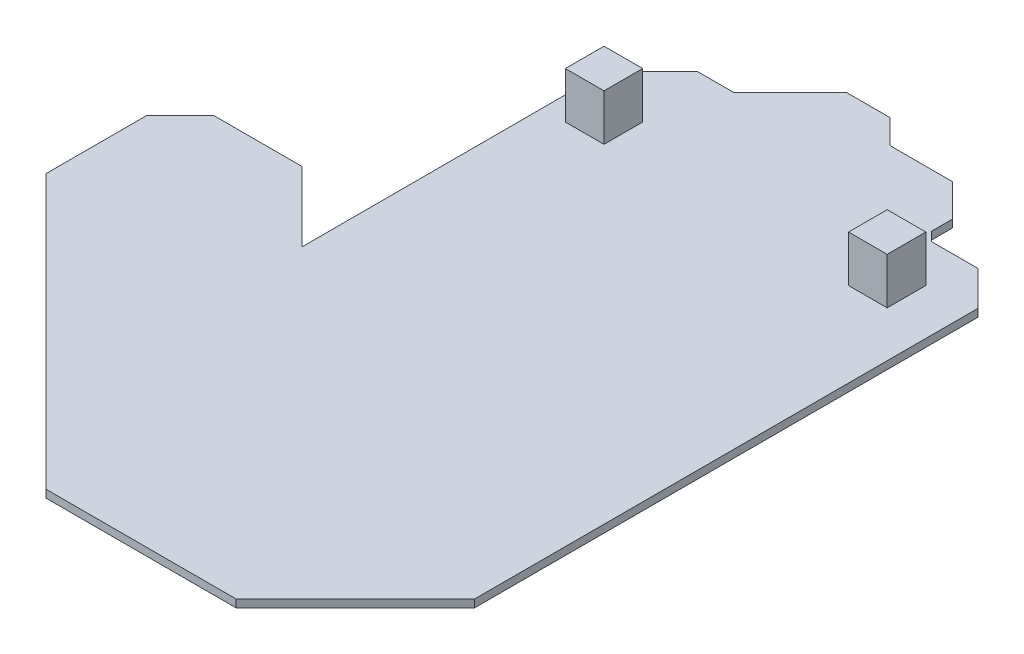
from build123d import *

# Parameters (mm, degrees)
RESSALTO_EXTRUS_O1_DEPTH = 1
ESBO_O2_W                = 5
ESBO_O2_H                = 5
RESSALTO_EXTRUS_O2_DEPTH = 6


with BuildPart() as part:
    # Esboço1 → Ressalto-extrusão1 (new body)
    with BuildSketch(Plane(origin=(0, 0, 0), x_dir=(1, 0, 0), z_dir=(0, 1, 0))):
        Polygon((-21.795929641, 4.783320054), (-12.808127222, -4.204482365), (-12.808127222, 35.123446913), (-6.91286311, 41.018711025), (-2.185714729, 41.018711025), (5.111319205, 48.315744958), (10.733649893, 48.315744958), (13.872231707, 45.177163144), (21.962429244, 45.177163144), (26.174966365, 40.964626022), (26.174966365, 38.275642193), (27.35031576, 37.100292798), (33.357124102, 37.100292798), (37.825539643, 32.631877257), (37.825539643, -32.506234834), (22.369869311, -47.961905165), (-2.211409105, -47.961905165), (-37.585857198, -12.587457072), (-37.585857198, 0.447182703), (-33.249719847, 4.783320054), align=None)
    extrude(amount=RESSALTO_EXTRUS_O1_DEPTH)

    # Esboço2 → Ressalto-extrusão2 (add)
    with BuildSketch(Plane(origin=(0, 1, 0), x_dir=(1, 0, 0), z_dir=(0, 1, 0))):
        with Locations((29.396408855, 29.306282823)):
            Rectangle(ESBO_O2_W, ESBO_O2_H)
        with Locations((-7.255035982, 29.306282823)):
            Rectangle(ESBO_O2_W, ESBO_O2_H)
    extrude(amount=RESSALTO_EXTRUS_O2_DEPTH)


solid = part.part
